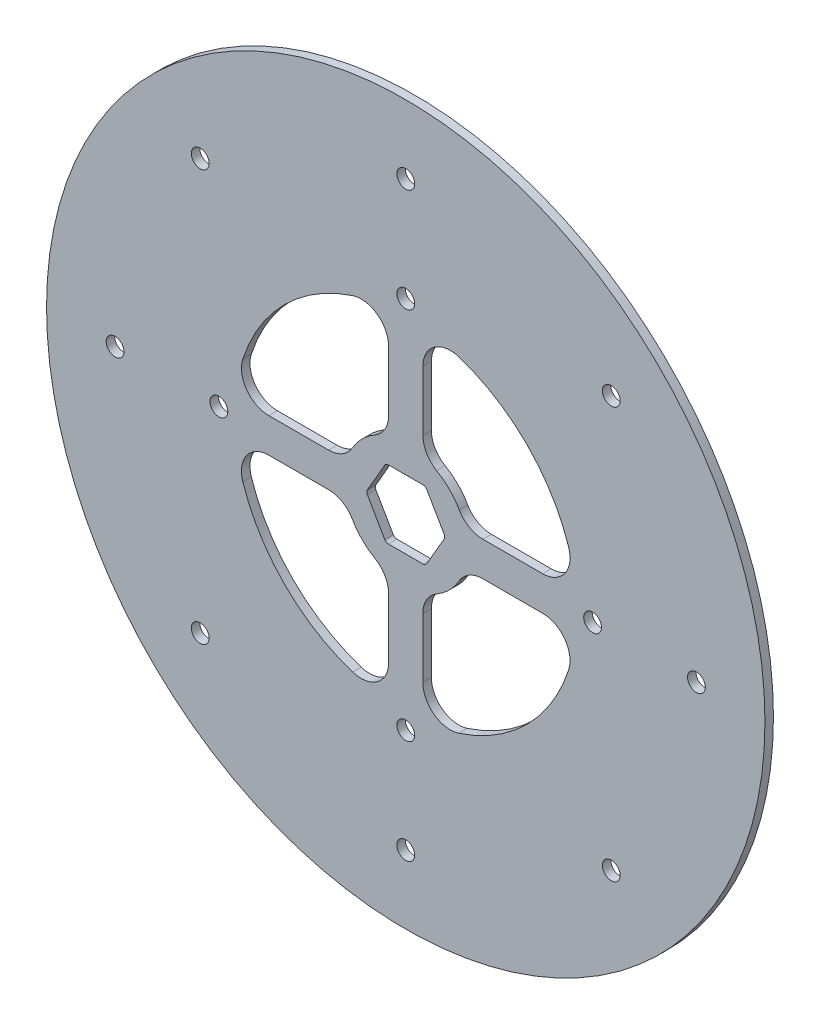
from build123d import *

# Parameters (mm, degrees)
SKETCH1_R           = 66.548
SKETCH1_R_2         = 1.651
BOSS_EXTRUDE1_DEPTH = 1.5748
FILLET6_R           = 0.762


with BuildPart() as part:
    # Sketch1 → Boss-Extrude1 (new body)
    with BuildSketch(Plane.XY):
        Circle(SKETCH1_R)
        with Locations((0, 53.848)):
            Circle(SKETCH1_R_2, mode=Mode.SUBTRACT)
        with Locations((0, 34.619591715)):
            Circle(SKETCH1_R_2, mode=Mode.SUBTRACT)
        with Locations((34.619591715, 0)):
            Circle(SKETCH1_R_2, mode=Mode.SUBTRACT)
        with Locations((0, -34.619591715)):
            Circle(SKETCH1_R_2, mode=Mode.SUBTRACT)
        with Locations((-34.619591715, 0)):
            Circle(SKETCH1_R_2, mode=Mode.SUBTRACT)
        with Locations((38.076285953, 38.076285953)):
            Circle(SKETCH1_R_2, mode=Mode.SUBTRACT)
        with Locations((53.848, 0)):
            Circle(SKETCH1_R_2, mode=Mode.SUBTRACT)
        with Locations((38.076285953, -38.076285953)):
            Circle(SKETCH1_R_2, mode=Mode.SUBTRACT)
        with Locations((0, -53.848)):
            Circle(SKETCH1_R_2, mode=Mode.SUBTRACT)
        with Locations((-38.076285953, -38.076285953)):
            Circle(SKETCH1_R_2, mode=Mode.SUBTRACT)
        with Locations((-53.848, 0)):
            Circle(SKETCH1_R_2, mode=Mode.SUBTRACT)
        with Locations((-38.076285953, 38.076285953)):
            Circle(SKETCH1_R_2, mode=Mode.SUBTRACT)
        with BuildLine():
            Line((25.360281446, 3.175), (14.298079416, 3.175))
            ThreePointArc((14.298079416, 3.175), (11.758079416, 3.855590949), (9.898670365, 5.715))
            ThreePointArc((9.898670365, 5.715), (8.082230509, 8.082230509), (5.715, 9.898670365))
            ThreePointArc((5.715, 9.898670365), (3.855590949, 11.758079416), (3.175, 14.298079416))
            Line((3.175, 14.298079416), (3.175, 25.360281446))
            ThreePointArc((3.175, 25.360281446), (5.270146171, 29.470883302), (9.827380952, 30.190811245))
            ThreePointArc((9.827380952, 30.190811245), (22.450640303, 22.450640303), (30.190811245, 9.827380952))
            ThreePointArc((30.190811245, 9.827380952), (29.470883302, 5.270146171), (25.360281446, 3.175))
        make_face(mode=Mode.SUBTRACT)
        with BuildLine():
            Line((-3.175, 25.360281446), (-3.175, 14.298079416))
            ThreePointArc((-3.175, 14.298079416), (-3.855590949, 11.758079416), (-5.715, 9.898670365))
            ThreePointArc((-5.715, 9.898670365), (-8.082230509, 8.082230509), (-9.898670365, 5.715))
            ThreePointArc((-9.898670365, 5.715), (-11.758079416, 3.855590949), (-14.298079416, 3.175))
            Line((-14.298079416, 3.175), (-25.360281446, 3.175))
            ThreePointArc((-25.360281446, 3.175), (-29.470883302, 5.270146171), (-30.190811245, 9.827380952))
            ThreePointArc((-30.190811245, 9.827380952), (-22.450640303, 22.450640303), (-9.827380952, 30.190811245))
            ThreePointArc((-9.827380952, 30.190811245), (-5.270146171, 29.470883302), (-3.175, 25.360281446))
        make_face(mode=Mode.SUBTRACT)
        with BuildLine():
            Line((3.175, -25.360281446), (3.175, -14.298079416))
            ThreePointArc((3.175, -14.298079416), (3.855590949, -11.758079416), (5.715, -9.898670365))
            ThreePointArc((5.715, -9.898670365), (8.082230509, -8.082230509), (9.898670365, -5.715))
            ThreePointArc((9.898670365, -5.715), (11.758079416, -3.855590949), (14.298079416, -3.175))
            Line((14.298079416, -3.175), (25.360281446, -3.175))
            ThreePointArc((25.360281446, -3.175), (29.470883302, -5.270146171), (30.190811245, -9.827380952))
            ThreePointArc((30.190811245, -9.827380952), (22.450640303, -22.450640303), (9.827380952, -30.190811245))
            ThreePointArc((9.827380952, -30.190811245), (5.270146171, -29.470883302), (3.175, -25.360281446))
        make_face(mode=Mode.SUBTRACT)
        Polygon((7.332348419, 0), (3.666174209, 6.35), (-3.666174209, 6.35), (-7.332348419, 0), (-3.666174209, -6.35), (3.666174209, -6.35), align=None, mode=Mode.SUBTRACT)
        with BuildLine():
            Line((-25.360281446, -3.175), (-14.298079416, -3.175))
            ThreePointArc((-14.298079416, -3.175), (-11.758079416, -3.855590949), (-9.898670365, -5.715))
            ThreePointArc((-9.898670365, -5.715), (-8.082230509, -8.082230509), (-5.715, -9.898670365))
            ThreePointArc((-5.715, -9.898670365), (-3.855590949, -11.758079416), (-3.175, -14.298079416))
            Line((-3.175, -14.298079416), (-3.175, -25.360281446))
            ThreePointArc((-3.175, -25.360281446), (-5.270146171, -29.470883302), (-9.827380952, -30.190811245))
            ThreePointArc((-9.827380952, -30.190811245), (-22.450640303, -22.450640303), (-30.190811245, -9.827380952))
            ThreePointArc((-30.190811245, -9.827380952), (-29.470883302, -5.270146171), (-25.360281446, -3.175))
        make_face(mode=Mode.SUBTRACT)
    extrude(amount=BOSS_EXTRUDE1_DEPTH)

    # Fillet6
    fillet6_edges = [part.edges().sort_by_distance(p)[0] for p in [
        (3.666174209, -6.35, 0.7874),
        (7.332348419, 0, 0.7874),
        (3.666174209, 6.35, 0.7874),
        (-3.666174209, 6.35, 0.7874),
        (-7.332348419, 0, 0.7874),
        (-3.666174209, -6.35, 0.7874),
    ]]
    fillet(fillet6_edges, radius=FILLET6_R)


solid = part.part
